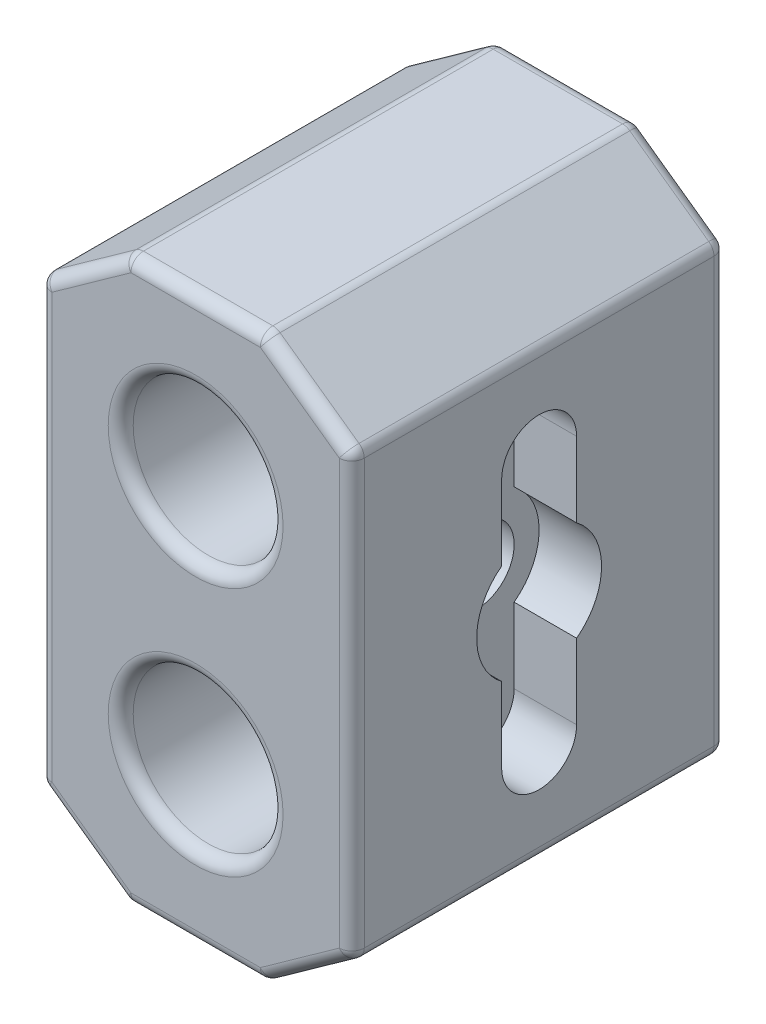
from build123d import *

# Parameters (mm, degrees)
SKETCH1_W                = 25
SKETCH1_H                = 45
BOSS_EXTRUDE1_DEPTH      = 30
CUT_EXTRUDE1_REACH       = 61.582
SKETCH2_R                = 6
CUT_EXTRUDE10_DEPTH      = 5
CUT_EXTRUDE11_DEPTH      = 60.581876439
CUT_EXTRUDE11_DEPTH_BACK = 60.581876439
CUT_EXTRUDE23_START      = -20
SKETCH9_R                = 3
CUT_EXTRUDE23_DEPTH      = 2
FILLET1_R                = 1


with BuildPart() as part:
    # Sketch1 → Boss-Extrude1 (new body)
    with BuildSketch(Plane.XY):
        with Locations((12.5, 22.5)):
            Rectangle(SKETCH1_W, SKETCH1_H)
    extrude(amount=BOSS_EXTRUDE1_DEPTH)

    # Sketch2 → Cut-Extrude1 (cut, up to next)
    with BuildSketch(Plane.XY.offset(30), mode=Mode.PRIVATE) as cut_extrude1_sk1:
        with Locations((12.5, 12.5)):
            Circle(SKETCH2_R)
    cut_extrude1_tool1 = extrude(cut_extrude1_sk1.sketch, amount=-CUT_EXTRUDE1_REACH, mode=Mode.PRIVATE) & part.part
    # Sketch2 → Cut-Extrude1 (cut, up to next)
    with BuildSketch(Plane.XY.offset(30), mode=Mode.PRIVATE) as cut_extrude1_sk2:
        with Locations((12.5, 32.5)):
            Circle(SKETCH2_R)
    cut_extrude1_tool2 = extrude(cut_extrude1_sk2.sketch, amount=-CUT_EXTRUDE1_REACH, mode=Mode.PRIVATE) & part.part
    add(cut_extrude1_tool1.solids().sort_by_distance((12.5, 12.5, 30))[0], mode=Mode.SUBTRACT)
    add(cut_extrude1_tool2.solids().sort_by_distance((12.5, 32.5, 30))[0], mode=Mode.SUBTRACT)

    # Sketch3 → Cut-Extrude10 (cut)
    with BuildSketch(Plane(origin=(25, 0, 0), x_dir=(0, 0, -1), z_dir=(1, 0, 0))):
        with BuildLine():
            Line((-12, 32.5), (-12, 26.5))
            ThreePointArc((-12, 26.5), (-10, 22.5), (-12, 18.5))
            Line((-12, 18.5), (-12, 12.5))
            ThreePointArc((-12, 12.5), (-15, 9.5), (-18, 12.5))
            Line((-18, 12.5), (-18, 18.5))
            ThreePointArc((-18, 18.5), (-20, 22.5), (-18, 26.5))
            Line((-18, 26.5), (-18, 32.5))
            ThreePointArc((-18, 32.5), (-15, 35.5), (-12, 32.5))
        make_face()
    extrude(amount=-CUT_EXTRUDE10_DEPTH, mode=Mode.SUBTRACT)

    # Sketch8 → Cut-Extrude11 (cut, two sides: drawn at the far end of the back side and taken through both)
    with BuildSketch(Plane.XY.offset(30).offset(-CUT_EXTRUDE11_DEPTH_BACK)):
        Polygon((7, 45), (0, 40), (0, 45), align=None)
        Polygon((0, 0), (7, 0), (0, 5), align=None)
        Polygon((25, 45), (25, 40), (18, 45), align=None)
        Polygon((25, 5), (18, 0), (25, 0), align=None)
    extrude(amount=CUT_EXTRUDE11_DEPTH + CUT_EXTRUDE11_DEPTH_BACK, mode=Mode.SUBTRACT)

    # Sketch9 → Cut-Extrude23 (cut)
    with BuildSketch(Plane.ZY.offset(CUT_EXTRUDE23_START)):
        with Locations(Location((15, 22.5, 0), (0, 0, 180))):
            Circle(SKETCH9_R)
    extrude(amount=CUT_EXTRUDE23_DEPTH, mode=Mode.SUBTRACT)

    # Fillet1
    fillet1_edges = [part.edges().sort_by_distance(p)[0] for p in [
        (6.5, 12.5, 0),
        (6.5, 12.5, 30),
        (6.5, 32.5, 0),
        (6.5, 32.5, 30),
        (0, 22.5, 0),
        (12.5, 45, 0),
        (25, 22.5, 0),
        (12.5, 0, 0),
        (0, 22.5, 30),
        (12.5, 0, 30),
        (25, 22.5, 30),
        (12.5, 45, 30),
        (18, 45, 15),
        (25, 40, 15),
        (21.5, 42.5, 30),
        (21.5, 42.5, 0),
        (0, 5, 15),
        (3.5, 2.5, 30),
        (3.5, 2.5, 0),
        (7, 0, 15),
        (18, 0, 15),
        (21.5, 2.5, 30),
        (21.5, 2.5, 0),
        (25, 5, 15),
        (0, 40, 15),
        (7, 45, 15),
        (3.5, 42.5, 30),
        (3.5, 42.5, 0),
    ]]
    fillet(fillet1_edges, radius=FILLET1_R)


solid = part.part
